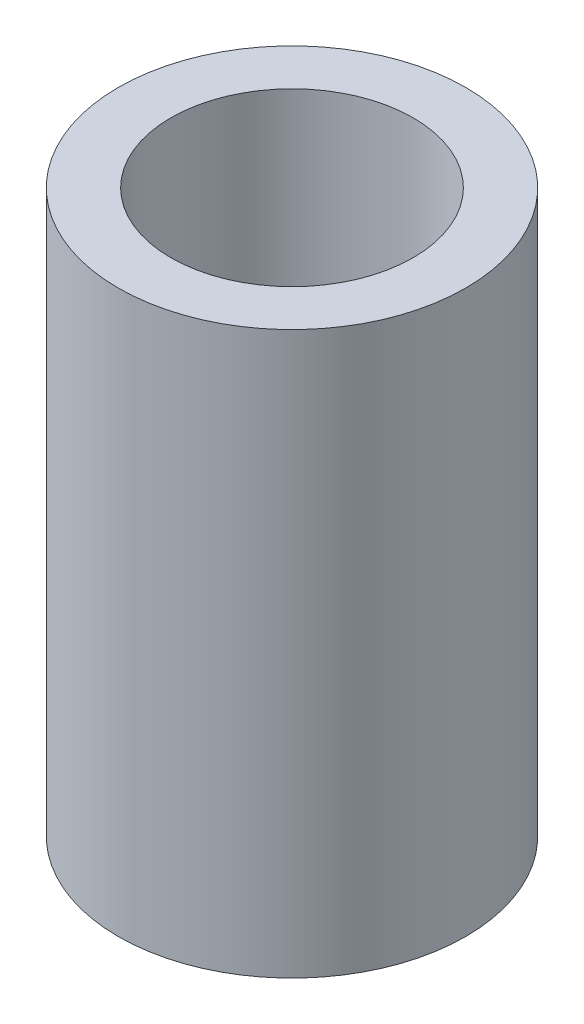
from build123d import *

# Parameters (mm, degrees)
SKETCH1_R           = 13.4366
SKETCH1_R_2         = 9.3726
BOSS_EXTRUDE1_DEPTH = 43.434


with BuildPart() as part:
    # Sketch1 → Boss-Extrude1 (new body)
    with BuildSketch(Plane.XZ.offset(-23.221373855)):
        with Locations(Location((-4.097798817, 0.355137676, 0), (0, 0, 90))):
            Circle(SKETCH1_R)
        with Locations(Location((-4.097798817, 0.355137676, 0), (0, 0, 90))):
            Circle(SKETCH1_R_2, mode=Mode.SUBTRACT)
    extrude(amount=BOSS_EXTRUDE1_DEPTH)


solid = part.part
